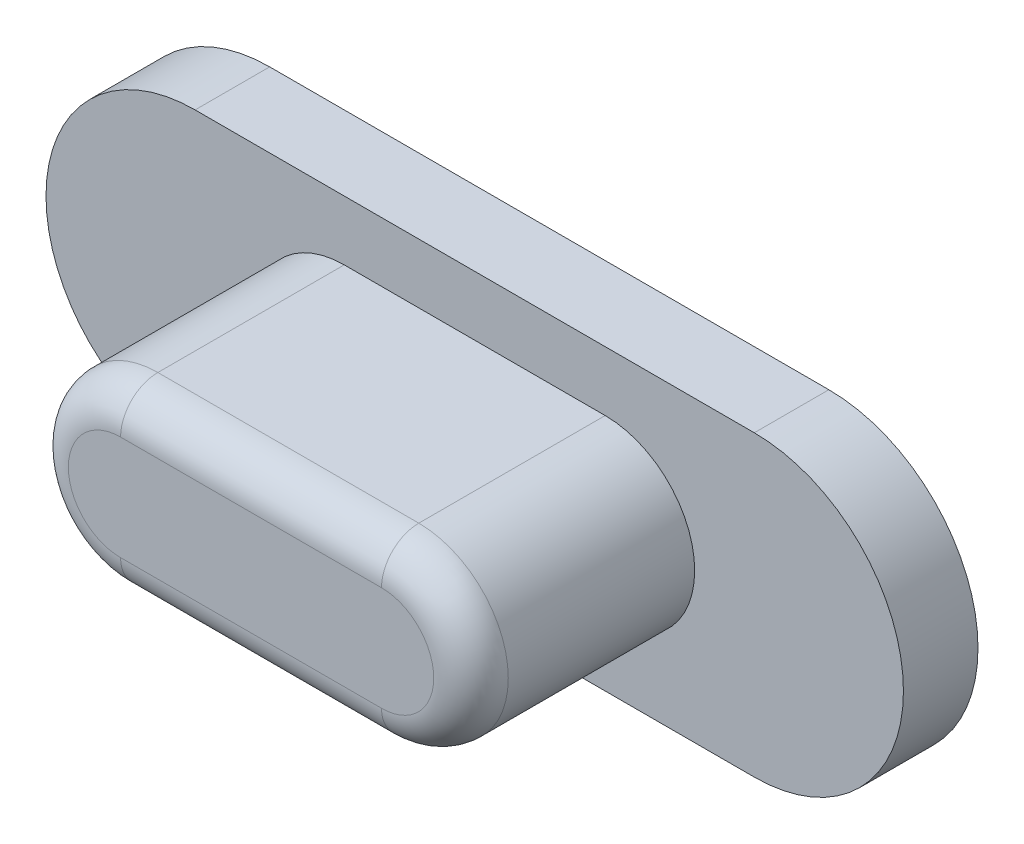
from build123d import *

# Parameters (mm, degrees)
EXTRUDE_1_DEPTH = 3
EXTRUDE_2_DEPTH = 1
FILLET_1_R      = 0.5


with BuildPart() as part:
    # 草图1 → 凸台-拉伸1 (new body)
    with BuildSketch(Plane.XY):
        with BuildLine():
            Line((1.25, 2.45), (4.75, 2.45))
            ThreePointArc((4.75, 2.45), (5.95, 1.25), (4.75, 0.05))
            Line((4.75, 0.05), (1.25, 0.05))
            ThreePointArc((1.25, 0.05), (0.05, 1.25), (1.25, 2.45))
        make_face()
    extrude(amount=EXTRUDE_1_DEPTH)

    # 草图2 → 凸台-拉伸2 (add)
    with BuildSketch(Plane(origin=(0, 0, 0), x_dir=(-1, 0, 0), z_dir=(0, 0, -1))):
        with BuildLine():
            Line((0.75, -0.75), (-6.75, -0.75))
            ThreePointArc((-6.75, -0.75), (-8.75, 1.25), (-6.75, 3.25))
            Line((-6.75, 3.25), (0.75, 3.25))
            ThreePointArc((0.75, 3.25), (2.75, 1.25), (0.75, -0.75))
        make_face()
    extrude(amount=EXTRUDE_2_DEPTH)

    # 圆角1
    fillet_1_edges = [part.edges().sort_by_distance(p)[0] for p in [
        (0.05, 1.25, 3),
        (3, 0.05, 3),
        (5.95, 1.25, 3),
        (3, 2.45, 3),
    ]]
    fillet(fillet_1_edges, radius=FILLET_1_R)


solid = part.part
